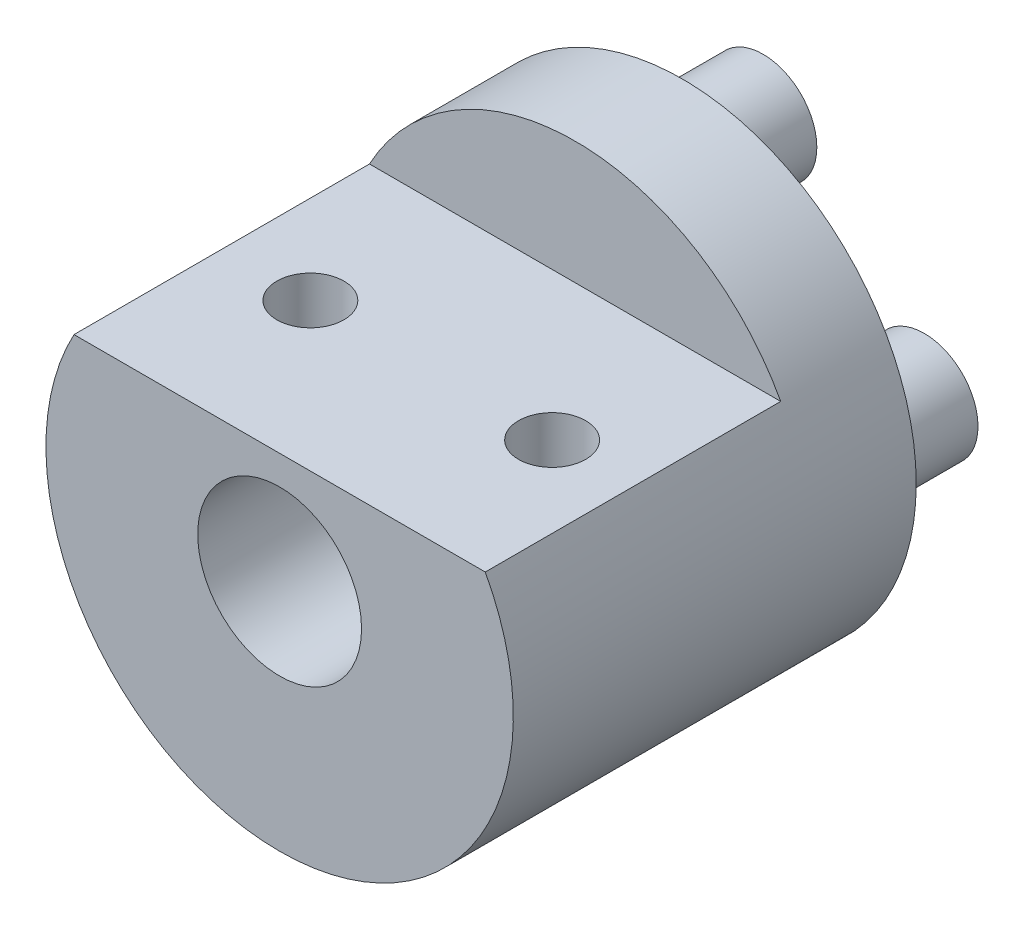
from build123d import *

# Parameters (mm, degrees)
SKETCH1_R                   = 8.7
BOSS_EXTRUDE1_DEPTH         = 15
SKETCH5_R                   = 1.75
CUT_EXTRUDE1_DEPTH          = 20.400515457
SKETCH6_R                   = 3.05
CUT_EXTRUDE3_DEPTH          = 12
SKETCH2_W                   = 17
SKETCH2_H                   = 4.566888769
CUT_EXTRUDE4_DEPTH          = 11
FILLET1_R                   = 0.3
TAP_DRILL_FOR_M3X0_5_TAP1_D = 2.5
SKETCH4_R                   = 2
BOSS_EXTRUDE2_DEPTH         = 3


with BuildPart() as part:
    # Sketch1 → Boss-Extrude1 (new body)
    with BuildSketch(Plane.XY):
        Circle(SKETCH1_R)
    extrude(amount=BOSS_EXTRUDE1_DEPTH)

    # Sketch5 → Cut-Extrude1 (cut, through all)
    with BuildSketch(Plane(origin=(0, 0, 0), x_dir=(-1, 0, 0), z_dir=(0, 0, -1))):
        Circle(SKETCH5_R)
    extrude(amount=-CUT_EXTRUDE1_DEPTH, mode=Mode.SUBTRACT)

    # Sketch6 → Cut-Extrude3 (cut)
    with BuildSketch(Plane.XY.offset(15)):
        Circle(SKETCH6_R)
    extrude(amount=-CUT_EXTRUDE3_DEPTH, mode=Mode.SUBTRACT)

    # Sketch2 → Cut-Extrude4 (cut)
    with BuildSketch(Plane.XY.offset(15)):
        with Locations((0.844453543, 6.416555616)):
            Rectangle(SKETCH2_W, SKETCH2_H)
    extrude(amount=-CUT_EXTRUDE4_DEPTH, mode=Mode.SUBTRACT)

    # Fillet1
    fillet1_edges = [part.edges().sort_by_distance(p)[0] for p in [
        (1.75, 0, 3),
    ]]
    fillet(fillet1_edges, radius=FILLET1_R)

    # Tap Drill for M3x0.5 Tap1 (through all)
    with Locations(Plane(origin=(0, 4.133111231, 0), x_dir=(1, 0, 0), z_dir=(0, 1, 0))):
        with Locations((-4.355546457, -9.5), (4.644453543, -9.5)):
            Hole(TAP_DRILL_FOR_M3X0_5_TAP1_D / 2)

    # Sketch4 → Boss-Extrude2 (add)
    with BuildSketch(Plane(origin=(0, 0, 0), x_dir=(-1, 0, 0), z_dir=(0, 0, -1))):
        with Locations(Location((0, 6, 0), (0, 0, 180))):
            Circle(SKETCH4_R)
        with Locations(Location((6, 0, 0), (0, 0, 180))):
            Circle(SKETCH4_R)
        with Locations(Location((0, -6, 0), (0, 0, 180))):
            Circle(SKETCH4_R)
        with Locations(Location((-6, 0, 0), (0, 0, 180))):
            Circle(SKETCH4_R)
    extrude(amount=BOSS_EXTRUDE2_DEPTH)


solid = part.part
